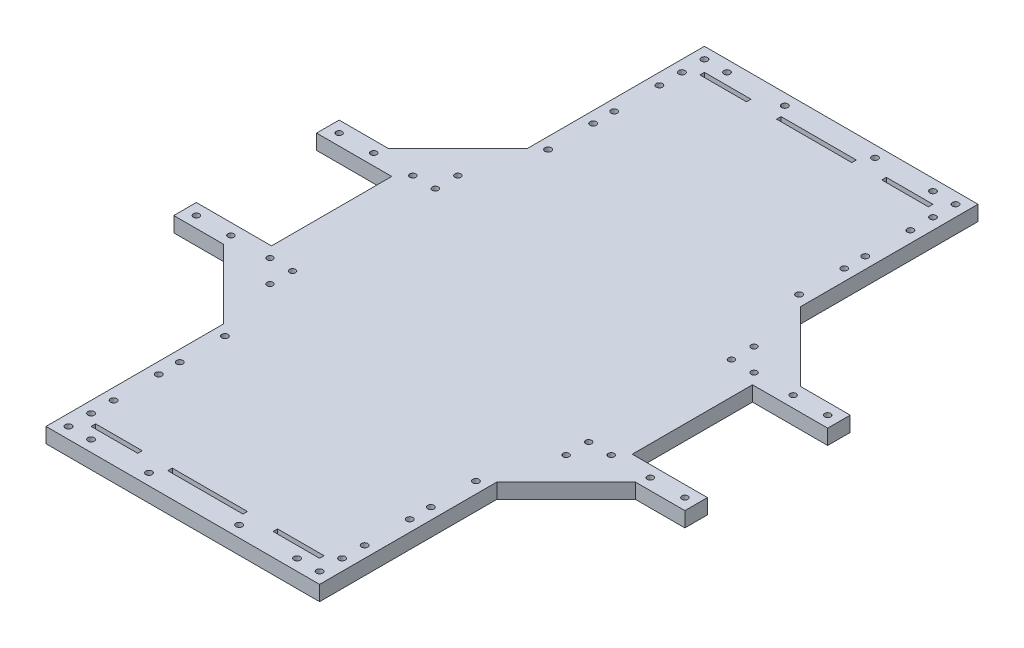
from build123d import *

# Parameters (mm, degrees)
BOSS_EXTRUDE1_DEPTH = 10
SKETCH2_R           = 2
SKETCH2_W           = 50
SKETCH2_H           = 80
CUT_EXTRUDE1_DEPTH  = 278.418456488
SKETCH3_R           = 2.1
SKETCH3_W           = 50
SKETCH3_H           = 3
SKETCH3_W_2         = 31
CUT_EXTRUDE2_DEPTH  = 278.418456488


with BuildPart() as part:
    # Sketch1 → Boss-Extrude1 (new body)
    with BuildSketch(Plane(origin=(0, 0, 0), x_dir=(1, 0, 0), z_dir=(0, 1, 0))):
        Polygon((-91, -219), (91, -219), (91, -101), (137, -55), (170, -55), (170, 55), (137, 55), (91, 101), (91, 219), (-91, 219), (-91, 101), (-137, 55), (-170, 55), (-170, -55), (-137, -55), (-91, -101), align=None)
    extrude(amount=BOSS_EXTRUDE1_DEPTH)

    # Sketch2 → Cut-Extrude1 (cut, through all)
    with BuildSketch(Plane(origin=(0, 10, 0), x_dir=(1, 0, 0), z_dir=(0, 1, 0))):
        with Locations(Location((-162.5, 47.5, 0), (0, 0, 270))):
            Circle(SKETCH2_R)
        with Locations(Location((-139.5, 47.5, 0), (0, 0, 270))):
            Circle(SKETCH2_R)
        with Locations(Location((-139.5, -47.5, 0), (0, 0, 90))):
            Circle(SKETCH2_R)
        with Locations(Location((-162.5, -47.5, 0), (0, 0, 90))):
            Circle(SKETCH2_R)
        with Locations(Location((-113.5, 47.5, 0), (0, 0, 270))):
            Circle(SKETCH2_R)
        with Locations(Location((-98.5, 47.5, 0), (0, 0, 270))):
            Circle(SKETCH2_R)
        with Locations(Location((-98.5, 62.5, 0), (0, 0, 270))):
            Circle(SKETCH2_R)
        with Locations(Location((-98.5, -62.5, 0), (0, 0, 90))):
            Circle(SKETCH2_R)
        with Locations(Location((-98.5, -47.5, 0), (0, 0, 90))):
            Circle(SKETCH2_R)
        with Locations(Location((-113.5, -47.5, 0), (0, 0, 90))):
            Circle(SKETCH2_R)
        with Locations(Location((113.5, -47.5, 0), (0, 0, 270))):
            Circle(SKETCH2_R)
        with Locations(Location((98.5, -47.5, 0), (0, 0, 270))):
            Circle(SKETCH2_R)
        with Locations(Location((98.5, -62.5, 0), (0, 0, 270))):
            Circle(SKETCH2_R)
        with Locations(Location((98.5, 62.5, 0), (0, 0, 90))):
            Circle(SKETCH2_R)
        with Locations(Location((98.5, 47.5, 0), (0, 0, 90))):
            Circle(SKETCH2_R)
        with Locations(Location((113.5, 47.5, 0), (0, 0, 90))):
            Circle(SKETCH2_R)
        with Locations(Location((162.5, -47.5, 0), (0, 0, 270))):
            Circle(SKETCH2_R)
        with Locations(Location((139.5, -47.5, 0), (0, 0, 270))):
            Circle(SKETCH2_R)
        with Locations(Location((139.5, 47.5, 0), (0, 0, 90))):
            Circle(SKETCH2_R)
        with Locations(Location((162.5, 47.5, 0), (0, 0, 90))):
            Circle(SKETCH2_R)
        with Locations((-145, 0)):
            Rectangle(SKETCH2_W, SKETCH2_H)
        with Locations((145, 0)):
            Rectangle(SKETCH2_W, SKETCH2_H)
    extrude(amount=-CUT_EXTRUDE1_DEPTH, mode=Mode.SUBTRACT)

    # Sketch3 → Cut-Extrude2 (cut, through all)
    with BuildSketch(Plane(origin=(0, 10, 0), x_dir=(1, 0, 0), z_dir=(0, 1, 0))):
        with Locations(Location((-30, 211.5, 0), (0, 0, 270))):
            Circle(SKETCH3_R)
        with Locations(Location((30, 211.5, 0), (0, 0, 270))):
            Circle(SKETCH3_R)
        with Locations(Location((68.5, 211.5, 0), (0, 0, 270))):
            Circle(SKETCH3_R)
        with Locations(Location((83.5, 211.5, 0), (0, 0, 270))):
            Circle(SKETCH3_R)
        with Locations(Location((83.5, 196.5, 0), (0, 0, 270))):
            Circle(SKETCH3_R)
        with Locations(Location((83.5, 181.5, 0), (0, 0, 270))):
            Circle(SKETCH3_R)
        with Locations(Location((83.5, 151.5, 0), (0, 0, 270))):
            Circle(SKETCH3_R)
        with Locations(Location((83.5, 137.5, 0), (0, 0, 270))):
            Circle(SKETCH3_R)
        with Locations(Location((83.5, 107.5, 0), (0, 0, 270))):
            Circle(SKETCH3_R)
        with Locations(Location((-83.5, 107.5, 0), (0, 0, 90))):
            Circle(SKETCH3_R)
        with Locations(Location((-83.5, 137.5, 0), (0, 0, 90))):
            Circle(SKETCH3_R)
        with Locations(Location((-83.5, 151.5, 0), (0, 0, 90))):
            Circle(SKETCH3_R)
        with Locations(Location((-83.5, 181.5, 0), (0, 0, 90))):
            Circle(SKETCH3_R)
        with Locations(Location((-83.5, 196.5, 0), (0, 0, 90))):
            Circle(SKETCH3_R)
        with Locations(Location((-83.5, 211.5, 0), (0, 0, 90))):
            Circle(SKETCH3_R)
        with Locations(Location((-68.5, 211.5, 0), (0, 0, 90))):
            Circle(SKETCH3_R)
        with Locations(Location((-68.5, -211.5, 0), (0, 0, 270))):
            Circle(SKETCH3_R)
        with Locations(Location((-83.5, -211.5, 0), (0, 0, 270))):
            Circle(SKETCH3_R)
        with Locations(Location((-83.5, -196.5, 0), (0, 0, 270))):
            Circle(SKETCH3_R)
        with Locations(Location((-83.5, -181.5, 0), (0, 0, 270))):
            Circle(SKETCH3_R)
        with Locations(Location((-83.5, -151.5, 0), (0, 0, 270))):
            Circle(SKETCH3_R)
        with Locations(Location((-83.5, -137.5, 0), (0, 0, 270))):
            Circle(SKETCH3_R)
        with Locations(Location((-83.5, -107.5, 0), (0, 0, 270))):
            Circle(SKETCH3_R)
        with Locations(Location((83.5, -107.5, 0), (0, 0, 90))):
            Circle(SKETCH3_R)
        with Locations(Location((83.5, -137.5, 0), (0, 0, 90))):
            Circle(SKETCH3_R)
        with Locations(Location((83.5, -151.5, 0), (0, 0, 90))):
            Circle(SKETCH3_R)
        with Locations(Location((83.5, -181.5, 0), (0, 0, 90))):
            Circle(SKETCH3_R)
        with Locations(Location((83.5, -196.5, 0), (0, 0, 90))):
            Circle(SKETCH3_R)
        with Locations(Location((83.5, -211.5, 0), (0, 0, 90))):
            Circle(SKETCH3_R)
        with Locations(Location((68.5, -211.5, 0), (0, 0, 90))):
            Circle(SKETCH3_R)
        with Locations(Location((30, -211.5, 0), (0, 0, 90))):
            Circle(SKETCH3_R)
        with Locations(Location((-30, -211.5, 0), (0, 0, 90))):
            Circle(SKETCH3_R)
        with Locations((0, 202.5)):
            Rectangle(SKETCH3_W, SKETCH3_H)
        with Locations((60.5, 202.5)):
            Rectangle(SKETCH3_W_2, SKETCH3_H)
        with Locations((-60.5, 202.5)):
            Rectangle(SKETCH3_W_2, SKETCH3_H)
        with Locations((-60.5, -202.5)):
            Rectangle(SKETCH3_W_2, SKETCH3_H)
        with Locations((60.5, -202.5)):
            Rectangle(SKETCH3_W_2, SKETCH3_H)
        with Locations((0, -202.5)):
            Rectangle(SKETCH3_W, SKETCH3_H)
    extrude(amount=-CUT_EXTRUDE2_DEPTH, mode=Mode.SUBTRACT)


solid = part.part
